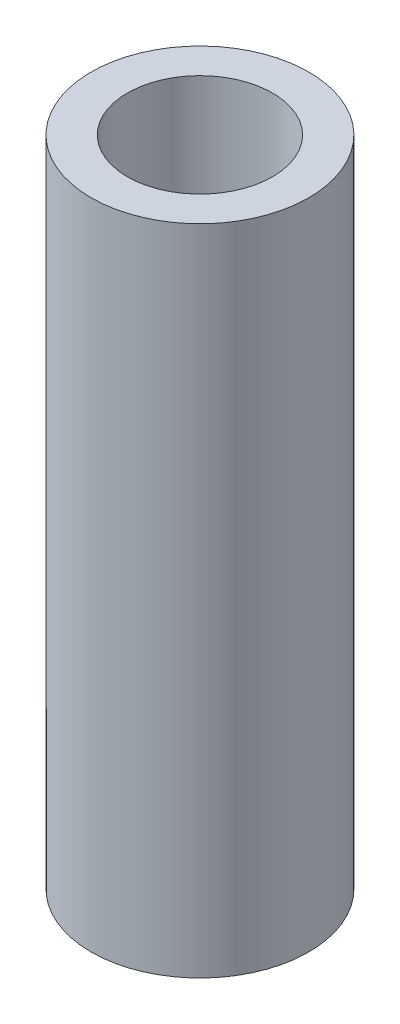
from build123d import *

# Parameters (mm, degrees)
SKETCH_1_R      = 3
SKETCH_1_R_2    = 2
EXTRUDE_1_DEPTH = 18


with BuildPart() as part:
    # Эскиз1 → Бобышка-Вытянуть1 (new body)
    with BuildSketch(Plane(origin=(0, 0, 0), x_dir=(1, 0, 0), z_dir=(0, 1, 0))):
        with Locations(Location((0, 0, 0), (0, 0, 270))):
            Circle(SKETCH_1_R)
        with Locations(Location((0, 0, 0), (0, 0, 270))):
            Circle(SKETCH_1_R_2, mode=Mode.SUBTRACT)
    extrude(amount=EXTRUDE_1_DEPTH)


solid = part.part
